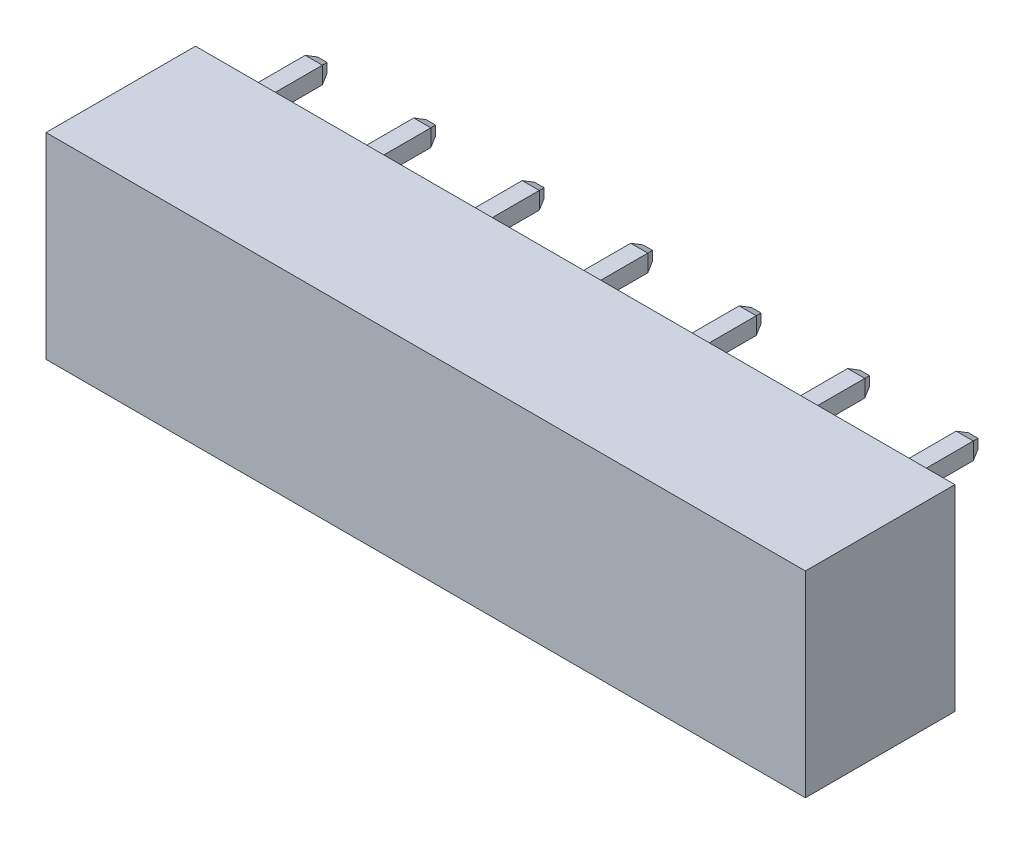
from build123d import *
from OCP.BRepFilletAPI import BRepFilletAPI_MakeChamfer

# Parameters (mm, degrees)
SKETCH_1_W                          = 35.56
SKETCH_1_H                          = 9.2
EXTRUDE_1_DEPTH                     = 7
SKETCH_2_W                          = 0.8
SKETCH_2_H                          = 0.8
EXTRUDE_2_DEPTH                     = 3.4
CHAMFER_1_SIZE                      = 0.4
CHAMFER_1_SIZE2                     = 0.178091474
CUT_EXTRUDE_1_DEPTH                 = 7
PATTERN_LINEAR_1_COUNT              = 7
PATTERN_LINEAR_1_PITCH              = 5.08
CHAMFER_1_OF_PATTERN_LINEAR_1_SIZE  = 0.4
CHAMFER_1_OF_PATTERN_LINEAR_1_SIZE2 = 0.178091474
PATTERN_LINEAR_2_COUNT              = 7
PATTERN_LINEAR_2_PITCH              = 5.08
SKETCH_4_W                          = 0.8
SKETCH_4_H                          = 0.8
EXTRUDE_3_DEPTH                     = 6
CHAMFER_2_SIZE                      = 0.4
CHAMFER_2_SIZE2                     = 0.178091474
PATTERN_LINEAR_3_COUNT              = 7
PATTERN_LINEAR_3_PITCH              = 5.08
CHAMFER_2_OF_PATTERN_LINEAR_3_SIZE  = 0.4
CHAMFER_2_OF_PATTERN_LINEAR_3_SIZE2 = 0.178091474


with BuildPart() as part:
    # Эскиз1 → Бобышка-Вытянуть1 (new body)
    with BuildSketch(Plane.XY):
        with Locations((0, 4.6)):
            Rectangle(SKETCH_1_W, SKETCH_1_H)
    extrude(amount=EXTRUDE_1_DEPTH)

    # Эскиз2 → Бобышка-Вытянуть2 (add)
    with BuildSketch(Plane(origin=(0, 0, 0), x_dir=(-1, 0, 0), z_dir=(0, 0, -1))):
        with Locations((-15.24, 8)):
            Rectangle(SKETCH_2_W, SKETCH_2_H)
    extrude_2 = extrude(amount=EXTRUDE_2_DEPTH)

    # Фаска1: one chamfer whose edges measure the first distance from different faces: ONE call of the kernel's chamfer builder (chamfer() names one face for all edges)
    chamfer_1_edges_1 = [part.edges().sort_by_distance(p)[0] for p in [
        (14.84, 8, -3.4),
    ]]
    chamfer_1_side_1 = [part.faces().sort_by_distance(p)[0] for p in [
        (14.84, 8, -1.7),
    ]]
    chamfer_1_edges_2 = [part.edges().sort_by_distance(p)[0] for p in [
        (15.24, 8.4, -3.4),
    ]]
    chamfer_1_side_2 = [part.faces().sort_by_distance(p)[0] for p in [
        (15.24, 8.4, -1.7),
    ]]
    chamfer_1_edges_3 = [part.edges().sort_by_distance(p)[0] for p in [
        (15.64, 8, -3.4),
    ]]
    chamfer_1_side_3 = [part.faces().sort_by_distance(p)[0] for p in [
        (15.64, 8, -1.7),
    ]]
    chamfer_1_edges_4 = [part.edges().sort_by_distance(p)[0] for p in [
        (15.24, 7.6, -3.4),
    ]]
    chamfer_1_side_4 = [part.faces().sort_by_distance(p)[0] for p in [
        (15.24, 7.6, -1.7),
    ]]
    chamfer_1 = BRepFilletAPI_MakeChamfer(part.part.solid().wrapped)
    for e in chamfer_1_edges_1:
        chamfer_1.Add(CHAMFER_1_SIZE, CHAMFER_1_SIZE2, e.wrapped, chamfer_1_side_1[0].wrapped)  # the first distance lies on this face
    for e in chamfer_1_edges_2:
        chamfer_1.Add(CHAMFER_1_SIZE, CHAMFER_1_SIZE2, e.wrapped, chamfer_1_side_2[0].wrapped)  # the first distance lies on this face
    for e in chamfer_1_edges_3:
        chamfer_1.Add(CHAMFER_1_SIZE, CHAMFER_1_SIZE2, e.wrapped, chamfer_1_side_3[0].wrapped)  # the first distance lies on this face
    for e in chamfer_1_edges_4:
        chamfer_1.Add(CHAMFER_1_SIZE, CHAMFER_1_SIZE2, e.wrapped, chamfer_1_side_4[0].wrapped)  # the first distance lies on this face
    add(Compound.cast(chamfer_1.Shape()), mode=Mode.REPLACE)

    # Эскиз3 → Вырез-Вытянуть1 (cut)
    with BuildSketch(Plane.XZ):
        Polygon((13.74, 0.8), (16.74, 0.8), (16.74, 5), (15.74, 5), (16.74, 6.5), (13.74, 6.5), (14.74, 5), (13.74, 5), align=None)
    cut_extrude_1 = extrude(amount=-CUT_EXTRUDE_1_DEPTH, mode=Mode.SUBTRACT)

    # Линейный массив1: Бобышка-Вытянуть2 ×7
    with Locations(*[(-i * PATTERN_LINEAR_1_PITCH, 0, 0) for i in range(1, PATTERN_LINEAR_1_COUNT)]):
        add(extrude_2)

    # Фаска1 of Линейный массив1: one chamfer whose edges measure the first distance from different faces: ONE call of the kernel's chamfer builder (chamfer() names one face for all edges)
    chamfer_1_of_pattern_linear_1_edges_1 = [part.edges().sort_by_distance(p)[0] for p in [
        (9.76, 8, -3.4),
    ]]
    chamfer_1_of_pattern_linear_1_side_1 = [part.faces().sort_by_distance(p)[0] for p in [
        (9.76, 8, -1.7),
    ]]
    chamfer_1_of_pattern_linear_1_edges_2 = [part.edges().sort_by_distance(p)[0] for p in [
        (10.16, 8.4, -3.4),
    ]]
    chamfer_1_of_pattern_linear_1_side_2 = [part.faces().sort_by_distance(p)[0] for p in [
        (10.16, 8.4, -1.7),
    ]]
    chamfer_1_of_pattern_linear_1_edges_3 = [part.edges().sort_by_distance(p)[0] for p in [
        (10.56, 8, -3.4),
    ]]
    chamfer_1_of_pattern_linear_1_side_3 = [part.faces().sort_by_distance(p)[0] for p in [
        (10.56, 8, -1.7),
    ]]
    chamfer_1_of_pattern_linear_1_edges_4 = [part.edges().sort_by_distance(p)[0] for p in [
        (10.16, 7.6, -3.4),
    ]]
    chamfer_1_of_pattern_linear_1_side_4 = [part.faces().sort_by_distance(p)[0] for p in [
        (10.16, 7.6, -1.7),
    ]]
    chamfer_1_of_pattern_linear_1_edges_5 = [part.edges().sort_by_distance(p)[0] for p in [
        (4.68, 8, -3.4),
    ]]
    chamfer_1_of_pattern_linear_1_side_5 = [part.faces().sort_by_distance(p)[0] for p in [
        (4.68, 8, -1.7),
    ]]
    chamfer_1_of_pattern_linear_1_edges_6 = [part.edges().sort_by_distance(p)[0] for p in [
        (5.08, 8.4, -3.4),
    ]]
    chamfer_1_of_pattern_linear_1_side_6 = [part.faces().sort_by_distance(p)[0] for p in [
        (5.08, 8.4, -1.7),
    ]]
    chamfer_1_of_pattern_linear_1_edges_7 = [part.edges().sort_by_distance(p)[0] for p in [
        (5.48, 8, -3.4),
    ]]
    chamfer_1_of_pattern_linear_1_side_7 = [part.faces().sort_by_distance(p)[0] for p in [
        (5.48, 8, -1.7),
    ]]
    chamfer_1_of_pattern_linear_1_edges_8 = [part.edges().sort_by_distance(p)[0] for p in [
        (5.08, 7.6, -3.4),
    ]]
    chamfer_1_of_pattern_linear_1_side_8 = [part.faces().sort_by_distance(p)[0] for p in [
        (5.08, 7.6, -1.7),
    ]]
    chamfer_1_of_pattern_linear_1_edges_9 = [part.edges().sort_by_distance(p)[0] for p in [
        (-0.4, 8, -3.4),
    ]]
    chamfer_1_of_pattern_linear_1_side_9 = [part.faces().sort_by_distance(p)[0] for p in [
        (-0.4, 8, -1.7),
    ]]
    chamfer_1_of_pattern_linear_1_edges_10 = [part.edges().sort_by_distance(p)[0] for p in [
        (0, 8.4, -3.4),
    ]]
    chamfer_1_of_pattern_linear_1_side_10 = [part.faces().sort_by_distance(p)[0] for p in [
        (0, 8.4, -1.7),
    ]]
    chamfer_1_of_pattern_linear_1_edges_11 = [part.edges().sort_by_distance(p)[0] for p in [
        (0.4, 8, -3.4),
    ]]
    chamfer_1_of_pattern_linear_1_side_11 = [part.faces().sort_by_distance(p)[0] for p in [
        (0.4, 8, -1.7),
    ]]
    chamfer_1_of_pattern_linear_1_edges_12 = [part.edges().sort_by_distance(p)[0] for p in [
        (0, 7.6, -3.4),
    ]]
    chamfer_1_of_pattern_linear_1_side_12 = [part.faces().sort_by_distance(p)[0] for p in [
        (0, 7.6, -1.7),
    ]]
    chamfer_1_of_pattern_linear_1_edges_13 = [part.edges().sort_by_distance(p)[0] for p in [
        (-5.48, 8, -3.4),
    ]]
    chamfer_1_of_pattern_linear_1_side_13 = [part.faces().sort_by_distance(p)[0] for p in [
        (-5.48, 8, -1.7),
    ]]
    chamfer_1_of_pattern_linear_1_edges_14 = [part.edges().sort_by_distance(p)[0] for p in [
        (-5.08, 8.4, -3.4),
    ]]
    chamfer_1_of_pattern_linear_1_side_14 = [part.faces().sort_by_distance(p)[0] for p in [
        (-5.08, 8.4, -1.7),
    ]]
    chamfer_1_of_pattern_linear_1_edges_15 = [part.edges().sort_by_distance(p)[0] for p in [
        (-4.68, 8, -3.4),
    ]]
    chamfer_1_of_pattern_linear_1_side_15 = [part.faces().sort_by_distance(p)[0] for p in [
        (-4.68, 8, -1.7),
    ]]
    chamfer_1_of_pattern_linear_1_edges_16 = [part.edges().sort_by_distance(p)[0] for p in [
        (-5.08, 7.6, -3.4),
    ]]
    chamfer_1_of_pattern_linear_1_side_16 = [part.faces().sort_by_distance(p)[0] for p in [
        (-5.08, 7.6, -1.7),
    ]]
    chamfer_1_of_pattern_linear_1_edges_17 = [part.edges().sort_by_distance(p)[0] for p in [
        (-10.56, 8, -3.4),
    ]]
    chamfer_1_of_pattern_linear_1_side_17 = [part.faces().sort_by_distance(p)[0] for p in [
        (-10.56, 8, -1.7),
    ]]
    chamfer_1_of_pattern_linear_1_edges_18 = [part.edges().sort_by_distance(p)[0] for p in [
        (-10.16, 8.4, -3.4),
    ]]
    chamfer_1_of_pattern_linear_1_side_18 = [part.faces().sort_by_distance(p)[0] for p in [
        (-10.16, 8.4, -1.7),
    ]]
    chamfer_1_of_pattern_linear_1_edges_19 = [part.edges().sort_by_distance(p)[0] for p in [
        (-9.76, 8, -3.4),
    ]]
    chamfer_1_of_pattern_linear_1_side_19 = [part.faces().sort_by_distance(p)[0] for p in [
        (-9.76, 8, -1.7),
    ]]
    chamfer_1_of_pattern_linear_1_edges_20 = [part.edges().sort_by_distance(p)[0] for p in [
        (-10.16, 7.6, -3.4),
    ]]
    chamfer_1_of_pattern_linear_1_side_20 = [part.faces().sort_by_distance(p)[0] for p in [
        (-10.16, 7.6, -1.7),
    ]]
    chamfer_1_of_pattern_linear_1_edges_21 = [part.edges().sort_by_distance(p)[0] for p in [
        (-15.64, 8, -3.4),
    ]]
    chamfer_1_of_pattern_linear_1_side_21 = [part.faces().sort_by_distance(p)[0] for p in [
        (-15.64, 8, -1.7),
    ]]
    chamfer_1_of_pattern_linear_1_edges_22 = [part.edges().sort_by_distance(p)[0] for p in [
        (-15.24, 8.4, -3.4),
    ]]
    chamfer_1_of_pattern_linear_1_side_22 = [part.faces().sort_by_distance(p)[0] for p in [
        (-15.24, 8.4, -1.7),
    ]]
    chamfer_1_of_pattern_linear_1_edges_23 = [part.edges().sort_by_distance(p)[0] for p in [
        (-14.84, 8, -3.4),
    ]]
    chamfer_1_of_pattern_linear_1_side_23 = [part.faces().sort_by_distance(p)[0] for p in [
        (-14.84, 8, -1.7),
    ]]
    chamfer_1_of_pattern_linear_1_edges_24 = [part.edges().sort_by_distance(p)[0] for p in [
        (-15.24, 7.6, -3.4),
    ]]
    chamfer_1_of_pattern_linear_1_side_24 = [part.faces().sort_by_distance(p)[0] for p in [
        (-15.24, 7.6, -1.7),
    ]]
    chamfer_1_of_pattern_linear_1 = BRepFilletAPI_MakeChamfer(part.part.solid().wrapped)
    for e in chamfer_1_of_pattern_linear_1_edges_1:
        chamfer_1_of_pattern_linear_1.Add(CHAMFER_1_OF_PATTERN_LINEAR_1_SIZE, CHAMFER_1_OF_PATTERN_LINEAR_1_SIZE2, e.wrapped, chamfer_1_of_pattern_linear_1_side_1[0].wrapped)  # the first distance lies on this face
    for e in chamfer_1_of_pattern_linear_1_edges_2:
        chamfer_1_of_pattern_linear_1.Add(CHAMFER_1_OF_PATTERN_LINEAR_1_SIZE, CHAMFER_1_OF_PATTERN_LINEAR_1_SIZE2, e.wrapped, chamfer_1_of_pattern_linear_1_side_2[0].wrapped)  # the first distance lies on this face
    for e in chamfer_1_of_pattern_linear_1_edges_3:
        chamfer_1_of_pattern_linear_1.Add(CHAMFER_1_OF_PATTERN_LINEAR_1_SIZE, CHAMFER_1_OF_PATTERN_LINEAR_1_SIZE2, e.wrapped, chamfer_1_of_pattern_linear_1_side_3[0].wrapped)  # the first distance lies on this face
    for e in chamfer_1_of_pattern_linear_1_edges_4:
        chamfer_1_of_pattern_linear_1.Add(CHAMFER_1_OF_PATTERN_LINEAR_1_SIZE, CHAMFER_1_OF_PATTERN_LINEAR_1_SIZE2, e.wrapped, chamfer_1_of_pattern_linear_1_side_4[0].wrapped)  # the first distance lies on this face
    for e in chamfer_1_of_pattern_linear_1_edges_5:
        chamfer_1_of_pattern_linear_1.Add(CHAMFER_1_OF_PATTERN_LINEAR_1_SIZE, CHAMFER_1_OF_PATTERN_LINEAR_1_SIZE2, e.wrapped, chamfer_1_of_pattern_linear_1_side_5[0].wrapped)  # the first distance lies on this face
    for e in chamfer_1_of_pattern_linear_1_edges_6:
        chamfer_1_of_pattern_linear_1.Add(CHAMFER_1_OF_PATTERN_LINEAR_1_SIZE, CHAMFER_1_OF_PATTERN_LINEAR_1_SIZE2, e.wrapped, chamfer_1_of_pattern_linear_1_side_6[0].wrapped)  # the first distance lies on this face
    for e in chamfer_1_of_pattern_linear_1_edges_7:
        chamfer_1_of_pattern_linear_1.Add(CHAMFER_1_OF_PATTERN_LINEAR_1_SIZE, CHAMFER_1_OF_PATTERN_LINEAR_1_SIZE2, e.wrapped, chamfer_1_of_pattern_linear_1_side_7[0].wrapped)  # the first distance lies on this face
    for e in chamfer_1_of_pattern_linear_1_edges_8:
        chamfer_1_of_pattern_linear_1.Add(CHAMFER_1_OF_PATTERN_LINEAR_1_SIZE, CHAMFER_1_OF_PATTERN_LINEAR_1_SIZE2, e.wrapped, chamfer_1_of_pattern_linear_1_side_8[0].wrapped)  # the first distance lies on this face
    for e in chamfer_1_of_pattern_linear_1_edges_9:
        chamfer_1_of_pattern_linear_1.Add(CHAMFER_1_OF_PATTERN_LINEAR_1_SIZE, CHAMFER_1_OF_PATTERN_LINEAR_1_SIZE2, e.wrapped, chamfer_1_of_pattern_linear_1_side_9[0].wrapped)  # the first distance lies on this face
    for e in chamfer_1_of_pattern_linear_1_edges_10:
        chamfer_1_of_pattern_linear_1.Add(CHAMFER_1_OF_PATTERN_LINEAR_1_SIZE, CHAMFER_1_OF_PATTERN_LINEAR_1_SIZE2, e.wrapped, chamfer_1_of_pattern_linear_1_side_10[0].wrapped)  # the first distance lies on this face
    for e in chamfer_1_of_pattern_linear_1_edges_11:
        chamfer_1_of_pattern_linear_1.Add(CHAMFER_1_OF_PATTERN_LINEAR_1_SIZE, CHAMFER_1_OF_PATTERN_LINEAR_1_SIZE2, e.wrapped, chamfer_1_of_pattern_linear_1_side_11[0].wrapped)  # the first distance lies on this face
    for e in chamfer_1_of_pattern_linear_1_edges_12:
        chamfer_1_of_pattern_linear_1.Add(CHAMFER_1_OF_PATTERN_LINEAR_1_SIZE, CHAMFER_1_OF_PATTERN_LINEAR_1_SIZE2, e.wrapped, chamfer_1_of_pattern_linear_1_side_12[0].wrapped)  # the first distance lies on this face
    for e in chamfer_1_of_pattern_linear_1_edges_13:
        chamfer_1_of_pattern_linear_1.Add(CHAMFER_1_OF_PATTERN_LINEAR_1_SIZE, CHAMFER_1_OF_PATTERN_LINEAR_1_SIZE2, e.wrapped, chamfer_1_of_pattern_linear_1_side_13[0].wrapped)  # the first distance lies on this face
    for e in chamfer_1_of_pattern_linear_1_edges_14:
        chamfer_1_of_pattern_linear_1.Add(CHAMFER_1_OF_PATTERN_LINEAR_1_SIZE, CHAMFER_1_OF_PATTERN_LINEAR_1_SIZE2, e.wrapped, chamfer_1_of_pattern_linear_1_side_14[0].wrapped)  # the first distance lies on this face
    for e in chamfer_1_of_pattern_linear_1_edges_15:
        chamfer_1_of_pattern_linear_1.Add(CHAMFER_1_OF_PATTERN_LINEAR_1_SIZE, CHAMFER_1_OF_PATTERN_LINEAR_1_SIZE2, e.wrapped, chamfer_1_of_pattern_linear_1_side_15[0].wrapped)  # the first distance lies on this face
    for e in chamfer_1_of_pattern_linear_1_edges_16:
        chamfer_1_of_pattern_linear_1.Add(CHAMFER_1_OF_PATTERN_LINEAR_1_SIZE, CHAMFER_1_OF_PATTERN_LINEAR_1_SIZE2, e.wrapped, chamfer_1_of_pattern_linear_1_side_16[0].wrapped)  # the first distance lies on this face
    for e in chamfer_1_of_pattern_linear_1_edges_17:
        chamfer_1_of_pattern_linear_1.Add(CHAMFER_1_OF_PATTERN_LINEAR_1_SIZE, CHAMFER_1_OF_PATTERN_LINEAR_1_SIZE2, e.wrapped, chamfer_1_of_pattern_linear_1_side_17[0].wrapped)  # the first distance lies on this face
    for e in chamfer_1_of_pattern_linear_1_edges_18:
        chamfer_1_of_pattern_linear_1.Add(CHAMFER_1_OF_PATTERN_LINEAR_1_SIZE, CHAMFER_1_OF_PATTERN_LINEAR_1_SIZE2, e.wrapped, chamfer_1_of_pattern_linear_1_side_18[0].wrapped)  # the first distance lies on this face
    for e in chamfer_1_of_pattern_linear_1_edges_19:
        chamfer_1_of_pattern_linear_1.Add(CHAMFER_1_OF_PATTERN_LINEAR_1_SIZE, CHAMFER_1_OF_PATTERN_LINEAR_1_SIZE2, e.wrapped, chamfer_1_of_pattern_linear_1_side_19[0].wrapped)  # the first distance lies on this face
    for e in chamfer_1_of_pattern_linear_1_edges_20:
        chamfer_1_of_pattern_linear_1.Add(CHAMFER_1_OF_PATTERN_LINEAR_1_SIZE, CHAMFER_1_OF_PATTERN_LINEAR_1_SIZE2, e.wrapped, chamfer_1_of_pattern_linear_1_side_20[0].wrapped)  # the first distance lies on this face
    for e in chamfer_1_of_pattern_linear_1_edges_21:
        chamfer_1_of_pattern_linear_1.Add(CHAMFER_1_OF_PATTERN_LINEAR_1_SIZE, CHAMFER_1_OF_PATTERN_LINEAR_1_SIZE2, e.wrapped, chamfer_1_of_pattern_linear_1_side_21[0].wrapped)  # the first distance lies on this face
    for e in chamfer_1_of_pattern_linear_1_edges_22:
        chamfer_1_of_pattern_linear_1.Add(CHAMFER_1_OF_PATTERN_LINEAR_1_SIZE, CHAMFER_1_OF_PATTERN_LINEAR_1_SIZE2, e.wrapped, chamfer_1_of_pattern_linear_1_side_22[0].wrapped)  # the first distance lies on this face
    for e in chamfer_1_of_pattern_linear_1_edges_23:
        chamfer_1_of_pattern_linear_1.Add(CHAMFER_1_OF_PATTERN_LINEAR_1_SIZE, CHAMFER_1_OF_PATTERN_LINEAR_1_SIZE2, e.wrapped, chamfer_1_of_pattern_linear_1_side_23[0].wrapped)  # the first distance lies on this face
    for e in chamfer_1_of_pattern_linear_1_edges_24:
        chamfer_1_of_pattern_linear_1.Add(CHAMFER_1_OF_PATTERN_LINEAR_1_SIZE, CHAMFER_1_OF_PATTERN_LINEAR_1_SIZE2, e.wrapped, chamfer_1_of_pattern_linear_1_side_24[0].wrapped)  # the first distance lies on this face
    add(Compound.cast(chamfer_1_of_pattern_linear_1.Shape()), mode=Mode.REPLACE)

    # Линейный массив2: Вырез-Вытянуть1 ×7
    with Locations(*[(-i * PATTERN_LINEAR_2_PITCH, 0, 0) for i in range(1, PATTERN_LINEAR_2_COUNT)]):
        add(cut_extrude_1, mode=Mode.SUBTRACT)

    # Эскиз4 → Бобышка-Вытянуть3 (add)
    with BuildSketch(Plane.XZ.offset(-7)):
        with Locations((15.24, 3)):
            Rectangle(SKETCH_4_W, SKETCH_4_H)
    extrude_3 = extrude(amount=EXTRUDE_3_DEPTH)

    # Фаска2: one chamfer whose edges measure the first distance from different faces: ONE call of the kernel's chamfer builder (chamfer() names one face for all edges)
    chamfer_2_edges_1 = [part.edges().sort_by_distance(p)[0] for p in [
        (15.64, 1, 3),
    ]]
    chamfer_2_side_1 = [part.faces().sort_by_distance(p)[0] for p in [
        (15.64, 4, 3),
    ]]
    chamfer_2_edges_2 = [part.edges().sort_by_distance(p)[0] for p in [
        (15.24, 1, 3.4),
    ]]
    chamfer_2_side_2 = [part.faces().sort_by_distance(p)[0] for p in [
        (15.24, 4, 3.4),
    ]]
    chamfer_2_edges_3 = [part.edges().sort_by_distance(p)[0] for p in [
        (14.84, 1, 3),
    ]]
    chamfer_2_side_3 = [part.faces().sort_by_distance(p)[0] for p in [
        (14.84, 4, 3),
    ]]
    chamfer_2_edges_4 = [part.edges().sort_by_distance(p)[0] for p in [
        (15.24, 1, 2.6),
    ]]
    chamfer_2_side_4 = [part.faces().sort_by_distance(p)[0] for p in [
        (15.24, 4, 2.6),
    ]]
    chamfer_2 = BRepFilletAPI_MakeChamfer(part.part.solid().wrapped)
    for e in chamfer_2_edges_1:
        chamfer_2.Add(CHAMFER_2_SIZE, CHAMFER_2_SIZE2, e.wrapped, chamfer_2_side_1[0].wrapped)  # the first distance lies on this face
    for e in chamfer_2_edges_2:
        chamfer_2.Add(CHAMFER_2_SIZE, CHAMFER_2_SIZE2, e.wrapped, chamfer_2_side_2[0].wrapped)  # the first distance lies on this face
    for e in chamfer_2_edges_3:
        chamfer_2.Add(CHAMFER_2_SIZE, CHAMFER_2_SIZE2, e.wrapped, chamfer_2_side_3[0].wrapped)  # the first distance lies on this face
    for e in chamfer_2_edges_4:
        chamfer_2.Add(CHAMFER_2_SIZE, CHAMFER_2_SIZE2, e.wrapped, chamfer_2_side_4[0].wrapped)  # the first distance lies on this face
    add(Compound.cast(chamfer_2.Shape()), mode=Mode.REPLACE)

    # Линейный массив3: Бобышка-Вытянуть3 ×7
    with Locations(*[(-i * PATTERN_LINEAR_3_PITCH, 0, 0) for i in range(1, PATTERN_LINEAR_3_COUNT)]):
        add(extrude_3)

    # Фаска2 of Линейный массив3: one chamfer whose edges measure the first distance from different faces: ONE call of the kernel's chamfer builder (chamfer() names one face for all edges)
    chamfer_2_of_pattern_linear_3_edges_1 = [part.edges().sort_by_distance(p)[0] for p in [
        (10.56, 1, 3),
    ]]
    chamfer_2_of_pattern_linear_3_side_1 = [part.faces().sort_by_distance(p)[0] for p in [
        (10.56, 4, 3),
    ]]
    chamfer_2_of_pattern_linear_3_edges_2 = [part.edges().sort_by_distance(p)[0] for p in [
        (10.16, 1, 3.4),
    ]]
    chamfer_2_of_pattern_linear_3_side_2 = [part.faces().sort_by_distance(p)[0] for p in [
        (10.16, 4, 3.4),
    ]]
    chamfer_2_of_pattern_linear_3_edges_3 = [part.edges().sort_by_distance(p)[0] for p in [
        (9.76, 1, 3),
    ]]
    chamfer_2_of_pattern_linear_3_side_3 = [part.faces().sort_by_distance(p)[0] for p in [
        (9.76, 4, 3),
    ]]
    chamfer_2_of_pattern_linear_3_edges_4 = [part.edges().sort_by_distance(p)[0] for p in [
        (10.16, 1, 2.6),
    ]]
    chamfer_2_of_pattern_linear_3_side_4 = [part.faces().sort_by_distance(p)[0] for p in [
        (10.16, 4, 2.6),
    ]]
    chamfer_2_of_pattern_linear_3_edges_5 = [part.edges().sort_by_distance(p)[0] for p in [
        (5.48, 1, 3),
    ]]
    chamfer_2_of_pattern_linear_3_side_5 = [part.faces().sort_by_distance(p)[0] for p in [
        (5.48, 4, 3),
    ]]
    chamfer_2_of_pattern_linear_3_edges_6 = [part.edges().sort_by_distance(p)[0] for p in [
        (5.08, 1, 3.4),
    ]]
    chamfer_2_of_pattern_linear_3_side_6 = [part.faces().sort_by_distance(p)[0] for p in [
        (5.08, 4, 3.4),
    ]]
    chamfer_2_of_pattern_linear_3_edges_7 = [part.edges().sort_by_distance(p)[0] for p in [
        (4.68, 1, 3),
    ]]
    chamfer_2_of_pattern_linear_3_side_7 = [part.faces().sort_by_distance(p)[0] for p in [
        (4.68, 4, 3),
    ]]
    chamfer_2_of_pattern_linear_3_edges_8 = [part.edges().sort_by_distance(p)[0] for p in [
        (5.08, 1, 2.6),
    ]]
    chamfer_2_of_pattern_linear_3_side_8 = [part.faces().sort_by_distance(p)[0] for p in [
        (5.08, 4, 2.6),
    ]]
    chamfer_2_of_pattern_linear_3_edges_9 = [part.edges().sort_by_distance(p)[0] for p in [
        (0.4, 1, 3),
    ]]
    chamfer_2_of_pattern_linear_3_side_9 = [part.faces().sort_by_distance(p)[0] for p in [
        (0.4, 4, 3),
    ]]
    chamfer_2_of_pattern_linear_3_edges_10 = [part.edges().sort_by_distance(p)[0] for p in [
        (0, 1, 3.4),
    ]]
    chamfer_2_of_pattern_linear_3_side_10 = [part.faces().sort_by_distance(p)[0] for p in [
        (0, 4, 3.4),
    ]]
    chamfer_2_of_pattern_linear_3_edges_11 = [part.edges().sort_by_distance(p)[0] for p in [
        (-0.4, 1, 3),
    ]]
    chamfer_2_of_pattern_linear_3_side_11 = [part.faces().sort_by_distance(p)[0] for p in [
        (-0.4, 4, 3),
    ]]
    chamfer_2_of_pattern_linear_3_edges_12 = [part.edges().sort_by_distance(p)[0] for p in [
        (0, 1, 2.6),
    ]]
    chamfer_2_of_pattern_linear_3_side_12 = [part.faces().sort_by_distance(p)[0] for p in [
        (0, 4, 2.6),
    ]]
    chamfer_2_of_pattern_linear_3_edges_13 = [part.edges().sort_by_distance(p)[0] for p in [
        (-4.68, 1, 3),
    ]]
    chamfer_2_of_pattern_linear_3_side_13 = [part.faces().sort_by_distance(p)[0] for p in [
        (-4.68, 4, 3),
    ]]
    chamfer_2_of_pattern_linear_3_edges_14 = [part.edges().sort_by_distance(p)[0] for p in [
        (-5.08, 1, 3.4),
    ]]
    chamfer_2_of_pattern_linear_3_side_14 = [part.faces().sort_by_distance(p)[0] for p in [
        (-5.08, 4, 3.4),
    ]]
    chamfer_2_of_pattern_linear_3_edges_15 = [part.edges().sort_by_distance(p)[0] for p in [
        (-5.48, 1, 3),
    ]]
    chamfer_2_of_pattern_linear_3_side_15 = [part.faces().sort_by_distance(p)[0] for p in [
        (-5.48, 4, 3),
    ]]
    chamfer_2_of_pattern_linear_3_edges_16 = [part.edges().sort_by_distance(p)[0] for p in [
        (-5.08, 1, 2.6),
    ]]
    chamfer_2_of_pattern_linear_3_side_16 = [part.faces().sort_by_distance(p)[0] for p in [
        (-5.08, 4, 2.6),
    ]]
    chamfer_2_of_pattern_linear_3_edges_17 = [part.edges().sort_by_distance(p)[0] for p in [
        (-9.76, 1, 3),
    ]]
    chamfer_2_of_pattern_linear_3_side_17 = [part.faces().sort_by_distance(p)[0] for p in [
        (-9.76, 4, 3),
    ]]
    chamfer_2_of_pattern_linear_3_edges_18 = [part.edges().sort_by_distance(p)[0] for p in [
        (-10.16, 1, 3.4),
    ]]
    chamfer_2_of_pattern_linear_3_side_18 = [part.faces().sort_by_distance(p)[0] for p in [
        (-10.16, 4, 3.4),
    ]]
    chamfer_2_of_pattern_linear_3_edges_19 = [part.edges().sort_by_distance(p)[0] for p in [
        (-10.56, 1, 3),
    ]]
    chamfer_2_of_pattern_linear_3_side_19 = [part.faces().sort_by_distance(p)[0] for p in [
        (-10.56, 4, 3),
    ]]
    chamfer_2_of_pattern_linear_3_edges_20 = [part.edges().sort_by_distance(p)[0] for p in [
        (-10.16, 1, 2.6),
    ]]
    chamfer_2_of_pattern_linear_3_side_20 = [part.faces().sort_by_distance(p)[0] for p in [
        (-10.16, 4, 2.6),
    ]]
    chamfer_2_of_pattern_linear_3_edges_21 = [part.edges().sort_by_distance(p)[0] for p in [
        (-14.84, 1, 3),
    ]]
    chamfer_2_of_pattern_linear_3_side_21 = [part.faces().sort_by_distance(p)[0] for p in [
        (-14.84, 4, 3),
    ]]
    chamfer_2_of_pattern_linear_3_edges_22 = [part.edges().sort_by_distance(p)[0] for p in [
        (-15.24, 1, 3.4),
    ]]
    chamfer_2_of_pattern_linear_3_side_22 = [part.faces().sort_by_distance(p)[0] for p in [
        (-15.24, 4, 3.4),
    ]]
    chamfer_2_of_pattern_linear_3_edges_23 = [part.edges().sort_by_distance(p)[0] for p in [
        (-15.64, 1, 3),
    ]]
    chamfer_2_of_pattern_linear_3_side_23 = [part.faces().sort_by_distance(p)[0] for p in [
        (-15.64, 4, 3),
    ]]
    chamfer_2_of_pattern_linear_3_edges_24 = [part.edges().sort_by_distance(p)[0] for p in [
        (-15.24, 1, 2.6),
    ]]
    chamfer_2_of_pattern_linear_3_side_24 = [part.faces().sort_by_distance(p)[0] for p in [
        (-15.24, 4, 2.6),
    ]]
    chamfer_2_of_pattern_linear_3 = BRepFilletAPI_MakeChamfer(part.part.solid().wrapped)
    for e in chamfer_2_of_pattern_linear_3_edges_1:
        chamfer_2_of_pattern_linear_3.Add(CHAMFER_2_OF_PATTERN_LINEAR_3_SIZE, CHAMFER_2_OF_PATTERN_LINEAR_3_SIZE2, e.wrapped, chamfer_2_of_pattern_linear_3_side_1[0].wrapped)  # the first distance lies on this face
    for e in chamfer_2_of_pattern_linear_3_edges_2:
        chamfer_2_of_pattern_linear_3.Add(CHAMFER_2_OF_PATTERN_LINEAR_3_SIZE, CHAMFER_2_OF_PATTERN_LINEAR_3_SIZE2, e.wrapped, chamfer_2_of_pattern_linear_3_side_2[0].wrapped)  # the first distance lies on this face
    for e in chamfer_2_of_pattern_linear_3_edges_3:
        chamfer_2_of_pattern_linear_3.Add(CHAMFER_2_OF_PATTERN_LINEAR_3_SIZE, CHAMFER_2_OF_PATTERN_LINEAR_3_SIZE2, e.wrapped, chamfer_2_of_pattern_linear_3_side_3[0].wrapped)  # the first distance lies on this face
    for e in chamfer_2_of_pattern_linear_3_edges_4:
        chamfer_2_of_pattern_linear_3.Add(CHAMFER_2_OF_PATTERN_LINEAR_3_SIZE, CHAMFER_2_OF_PATTERN_LINEAR_3_SIZE2, e.wrapped, chamfer_2_of_pattern_linear_3_side_4[0].wrapped)  # the first distance lies on this face
    for e in chamfer_2_of_pattern_linear_3_edges_5:
        chamfer_2_of_pattern_linear_3.Add(CHAMFER_2_OF_PATTERN_LINEAR_3_SIZE, CHAMFER_2_OF_PATTERN_LINEAR_3_SIZE2, e.wrapped, chamfer_2_of_pattern_linear_3_side_5[0].wrapped)  # the first distance lies on this face
    for e in chamfer_2_of_pattern_linear_3_edges_6:
        chamfer_2_of_pattern_linear_3.Add(CHAMFER_2_OF_PATTERN_LINEAR_3_SIZE, CHAMFER_2_OF_PATTERN_LINEAR_3_SIZE2, e.wrapped, chamfer_2_of_pattern_linear_3_side_6[0].wrapped)  # the first distance lies on this face
    for e in chamfer_2_of_pattern_linear_3_edges_7:
        chamfer_2_of_pattern_linear_3.Add(CHAMFER_2_OF_PATTERN_LINEAR_3_SIZE, CHAMFER_2_OF_PATTERN_LINEAR_3_SIZE2, e.wrapped, chamfer_2_of_pattern_linear_3_side_7[0].wrapped)  # the first distance lies on this face
    for e in chamfer_2_of_pattern_linear_3_edges_8:
        chamfer_2_of_pattern_linear_3.Add(CHAMFER_2_OF_PATTERN_LINEAR_3_SIZE, CHAMFER_2_OF_PATTERN_LINEAR_3_SIZE2, e.wrapped, chamfer_2_of_pattern_linear_3_side_8[0].wrapped)  # the first distance lies on this face
    for e in chamfer_2_of_pattern_linear_3_edges_9:
        chamfer_2_of_pattern_linear_3.Add(CHAMFER_2_OF_PATTERN_LINEAR_3_SIZE, CHAMFER_2_OF_PATTERN_LINEAR_3_SIZE2, e.wrapped, chamfer_2_of_pattern_linear_3_side_9[0].wrapped)  # the first distance lies on this face
    for e in chamfer_2_of_pattern_linear_3_edges_10:
        chamfer_2_of_pattern_linear_3.Add(CHAMFER_2_OF_PATTERN_LINEAR_3_SIZE, CHAMFER_2_OF_PATTERN_LINEAR_3_SIZE2, e.wrapped, chamfer_2_of_pattern_linear_3_side_10[0].wrapped)  # the first distance lies on this face
    for e in chamfer_2_of_pattern_linear_3_edges_11:
        chamfer_2_of_pattern_linear_3.Add(CHAMFER_2_OF_PATTERN_LINEAR_3_SIZE, CHAMFER_2_OF_PATTERN_LINEAR_3_SIZE2, e.wrapped, chamfer_2_of_pattern_linear_3_side_11[0].wrapped)  # the first distance lies on this face
    for e in chamfer_2_of_pattern_linear_3_edges_12:
        chamfer_2_of_pattern_linear_3.Add(CHAMFER_2_OF_PATTERN_LINEAR_3_SIZE, CHAMFER_2_OF_PATTERN_LINEAR_3_SIZE2, e.wrapped, chamfer_2_of_pattern_linear_3_side_12[0].wrapped)  # the first distance lies on this face
    for e in chamfer_2_of_pattern_linear_3_edges_13:
        chamfer_2_of_pattern_linear_3.Add(CHAMFER_2_OF_PATTERN_LINEAR_3_SIZE, CHAMFER_2_OF_PATTERN_LINEAR_3_SIZE2, e.wrapped, chamfer_2_of_pattern_linear_3_side_13[0].wrapped)  # the first distance lies on this face
    for e in chamfer_2_of_pattern_linear_3_edges_14:
        chamfer_2_of_pattern_linear_3.Add(CHAMFER_2_OF_PATTERN_LINEAR_3_SIZE, CHAMFER_2_OF_PATTERN_LINEAR_3_SIZE2, e.wrapped, chamfer_2_of_pattern_linear_3_side_14[0].wrapped)  # the first distance lies on this face
    for e in chamfer_2_of_pattern_linear_3_edges_15:
        chamfer_2_of_pattern_linear_3.Add(CHAMFER_2_OF_PATTERN_LINEAR_3_SIZE, CHAMFER_2_OF_PATTERN_LINEAR_3_SIZE2, e.wrapped, chamfer_2_of_pattern_linear_3_side_15[0].wrapped)  # the first distance lies on this face
    for e in chamfer_2_of_pattern_linear_3_edges_16:
        chamfer_2_of_pattern_linear_3.Add(CHAMFER_2_OF_PATTERN_LINEAR_3_SIZE, CHAMFER_2_OF_PATTERN_LINEAR_3_SIZE2, e.wrapped, chamfer_2_of_pattern_linear_3_side_16[0].wrapped)  # the first distance lies on this face
    for e in chamfer_2_of_pattern_linear_3_edges_17:
        chamfer_2_of_pattern_linear_3.Add(CHAMFER_2_OF_PATTERN_LINEAR_3_SIZE, CHAMFER_2_OF_PATTERN_LINEAR_3_SIZE2, e.wrapped, chamfer_2_of_pattern_linear_3_side_17[0].wrapped)  # the first distance lies on this face
    for e in chamfer_2_of_pattern_linear_3_edges_18:
        chamfer_2_of_pattern_linear_3.Add(CHAMFER_2_OF_PATTERN_LINEAR_3_SIZE, CHAMFER_2_OF_PATTERN_LINEAR_3_SIZE2, e.wrapped, chamfer_2_of_pattern_linear_3_side_18[0].wrapped)  # the first distance lies on this face
    for e in chamfer_2_of_pattern_linear_3_edges_19:
        chamfer_2_of_pattern_linear_3.Add(CHAMFER_2_OF_PATTERN_LINEAR_3_SIZE, CHAMFER_2_OF_PATTERN_LINEAR_3_SIZE2, e.wrapped, chamfer_2_of_pattern_linear_3_side_19[0].wrapped)  # the first distance lies on this face
    for e in chamfer_2_of_pattern_linear_3_edges_20:
        chamfer_2_of_pattern_linear_3.Add(CHAMFER_2_OF_PATTERN_LINEAR_3_SIZE, CHAMFER_2_OF_PATTERN_LINEAR_3_SIZE2, e.wrapped, chamfer_2_of_pattern_linear_3_side_20[0].wrapped)  # the first distance lies on this face
    for e in chamfer_2_of_pattern_linear_3_edges_21:
        chamfer_2_of_pattern_linear_3.Add(CHAMFER_2_OF_PATTERN_LINEAR_3_SIZE, CHAMFER_2_OF_PATTERN_LINEAR_3_SIZE2, e.wrapped, chamfer_2_of_pattern_linear_3_side_21[0].wrapped)  # the first distance lies on this face
    for e in chamfer_2_of_pattern_linear_3_edges_22:
        chamfer_2_of_pattern_linear_3.Add(CHAMFER_2_OF_PATTERN_LINEAR_3_SIZE, CHAMFER_2_OF_PATTERN_LINEAR_3_SIZE2, e.wrapped, chamfer_2_of_pattern_linear_3_side_22[0].wrapped)  # the first distance lies on this face
    for e in chamfer_2_of_pattern_linear_3_edges_23:
        chamfer_2_of_pattern_linear_3.Add(CHAMFER_2_OF_PATTERN_LINEAR_3_SIZE, CHAMFER_2_OF_PATTERN_LINEAR_3_SIZE2, e.wrapped, chamfer_2_of_pattern_linear_3_side_23[0].wrapped)  # the first distance lies on this face
    for e in chamfer_2_of_pattern_linear_3_edges_24:
        chamfer_2_of_pattern_linear_3.Add(CHAMFER_2_OF_PATTERN_LINEAR_3_SIZE, CHAMFER_2_OF_PATTERN_LINEAR_3_SIZE2, e.wrapped, chamfer_2_of_pattern_linear_3_side_24[0].wrapped)  # the first distance lies on this face
    add(Compound.cast(chamfer_2_of_pattern_linear_3.Shape()), mode=Mode.REPLACE)


solid = part.part
